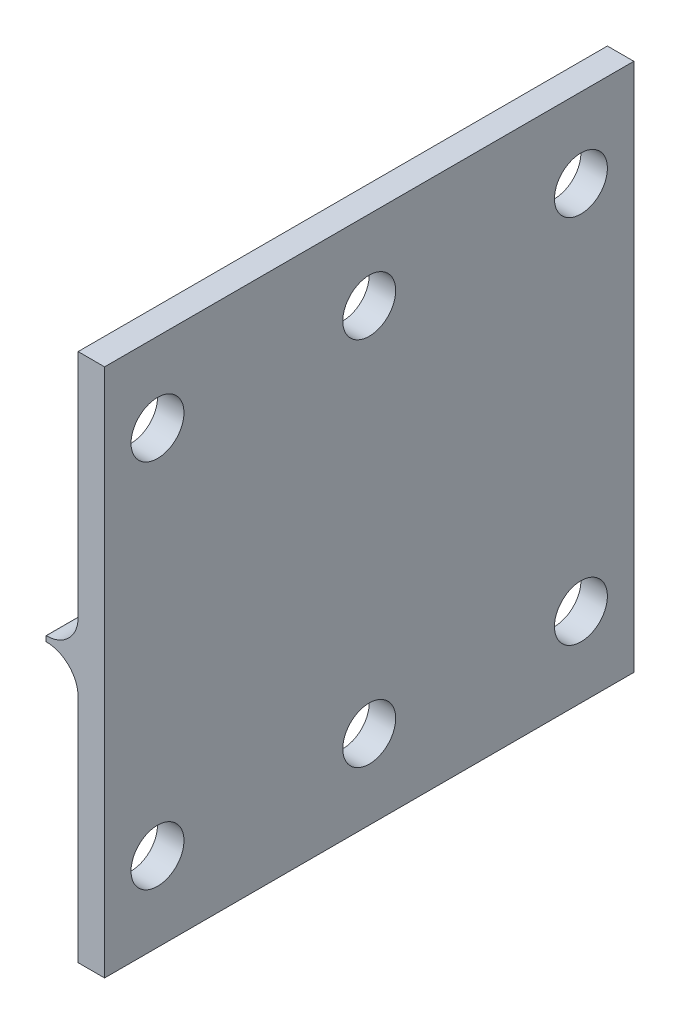
from build123d import *

# Parameters (mm, degrees)
EXTRUDE1_DEPTH     = 500
SKETCH3_R          = 25
CUT_EXTRUDE1_DEPTH = 672.710252301


with BuildPart() as part:
    # Sketch1 → Extrude1 (new body)
    with BuildSketch(Plane.XY):
        with BuildLine():
            Line((-25, 447.529481132), (0, 447.529481132))
            Line((0, 447.529481132), (0, -52.470518868))
            Line((0, -52.470518868), (-25, -52.470518868))
            Line((-25, -52.470518868), (-25, 0))
            Line((-25, 0), (-25, 165.029481132))
            ThreePointArc((-25, 165.029481132), (-33.786796564, 186.242684568), (-55, 195.029481132))
            Line((-55, 195.029481132), (-55.199777542, 195.029481132))
            Line((-55.199777542, 195.029481132), (-55.199777542, 200.029481132))
            Line((-55.199777542, 200.029481132), (-55, 200.029481132))
            ThreePointArc((-55, 200.029481132), (-33.786796564, 208.816277696), (-25, 230.029481132))
            Line((-25, 230.029481132), (-25, 447.529481132))
        make_face()
    extrude(amount=EXTRUDE1_DEPTH)

    # Sketch3 → Cut-Extrude1 (cut, through all)
    with BuildSketch(Plane.ZY.offset(25)):
        with Locations((450, 22.529481132)):
            Circle(SKETCH3_R)
        with Locations((250, 22.529481132)):
            Circle(SKETCH3_R)
        with Locations((50, 22.529481132)):
            Circle(SKETCH3_R)
        with Locations((450, 372.529481132)):
            Circle(SKETCH3_R)
        with Locations((250, 372.529481132)):
            Circle(SKETCH3_R)
        with Locations((50, 372.529481132)):
            Circle(SKETCH3_R)
    extrude(amount=-CUT_EXTRUDE1_DEPTH, mode=Mode.SUBTRACT)


solid = part.part
